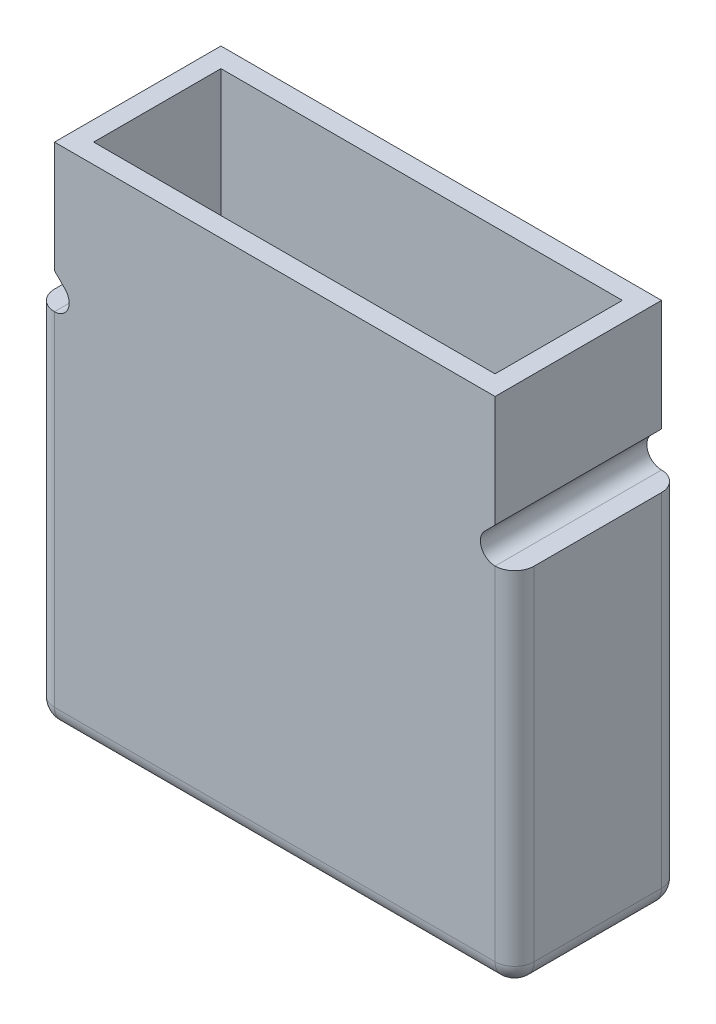
from build123d import *

# Parameters (mm, degrees)
SKETCH1_W          = 49
SKETCH1_H          = 17
SKETCH1_W_2        = 41
SKETCH1_H_2        = 13
EXTRUDE1_DEPTH     = 50
CUT_EXTRUDE3_DEPTH = 21
SKETCH3_W          = 49
SKETCH3_H          = 17
EXTRUDE2_DEPTH     = 2
FILLET1_R          = 2


with BuildPart() as part:
    # Sketch1 → Extrude1 (new body)
    with BuildSketch(Plane(origin=(0, 0, 0), x_dir=(1, 0, 0), z_dir=(0, 1, 0))):
        Rectangle(SKETCH1_W, SKETCH1_H)
        Rectangle(SKETCH1_W_2, SKETCH1_H_2, mode=Mode.SUBTRACT)
    extrude(amount=EXTRUDE1_DEPTH)

    # Sketch2 → Cut-Extrude3 (cut)
    with BuildSketch(Plane.XY.offset(8.5)):
        with BuildLine():
            Line((-21.439339828, 37.560660172), (-22.5, 38.621320344))
            Line((-22.5, 38.621320344), (-22.5, 50))
            Line((-22.5, 50), (-24.5, 50))
            Line((-24.5, 50), (-24.5, 35))
            Line((-24.5, 35), (-22.5, 35))
            ThreePointArc((-22.5, 35), (-21.114180701, 35.925974851), (-21.439339828, 37.560660172))
        make_face()
        with BuildLine():
            Line((24.5, 50), (22.5, 50))
            Line((22.5, 50), (22.5, 38.621320344))
            Line((22.5, 38.621320344), (21.439339828, 37.560660172))
            ThreePointArc((21.439339828, 37.560660172), (21.114180701, 35.925974851), (22.5, 35))
            Line((22.5, 35), (24.5, 35))
            Line((24.5, 35), (24.5, 50))
        make_face()
    extrude(amount=-CUT_EXTRUDE3_DEPTH, mode=Mode.SUBTRACT)

    # Sketch3 → Extrude2 (add)
    with BuildSketch(Plane.XZ):
        Rectangle(SKETCH3_W, SKETCH3_H)
    extrude(amount=EXTRUDE2_DEPTH)

    # Fillet1
    fillet1_edges = [part.edges().sort_by_distance(p)[0] for p in [
        (-24.5, 16.5, -8.5),
        (-24.5, 16.5, 8.5),
        (24.5, 16.5, -8.5),
        (24.5, 16.5, 8.5),
        (-24.5, -2, 0),
        (0, -2, -8.5),
        (24.5, -2, 0),
        (0, -2, 8.5),
    ]]
    fillet(fillet1_edges, radius=FILLET1_R)


solid = part.part
